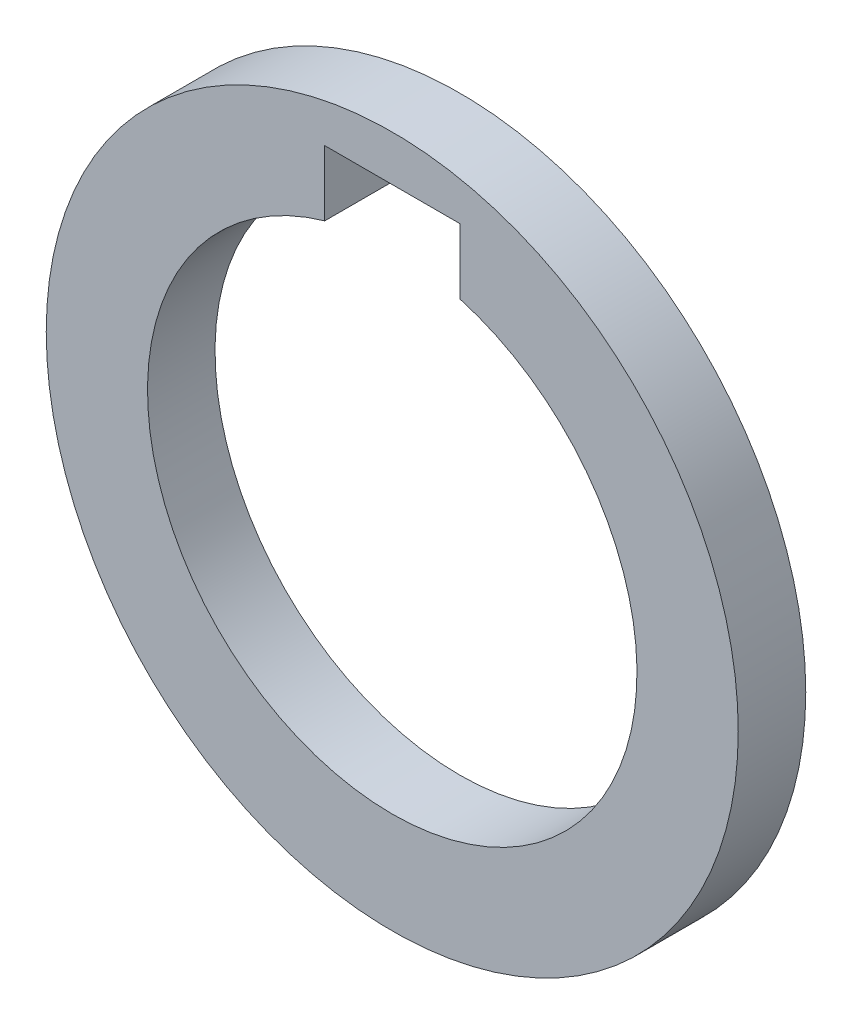
from build123d import *

# Parameters (mm, degrees)
SKETCH_1_R      = 20.5
EXTRUDE_1_DEPTH = 4


with BuildPart() as part:
    # 草图1 → 凸台-拉伸1 (new body)
    with BuildSketch(Plane.XY):
        Circle(SKETCH_1_R)
        with BuildLine():
            Line((-4, 13.937359865), (-4, 17.8))
            Line((-4, 17.8), (4, 17.8))
            Line((4, 17.8), (4, 13.937359865))
            ThreePointArc((4, 13.937359865), (0, -14.5), (-4, 13.937359865))
        make_face(mode=Mode.SUBTRACT)
    extrude(amount=EXTRUDE_1_DEPTH)


solid = part.part
